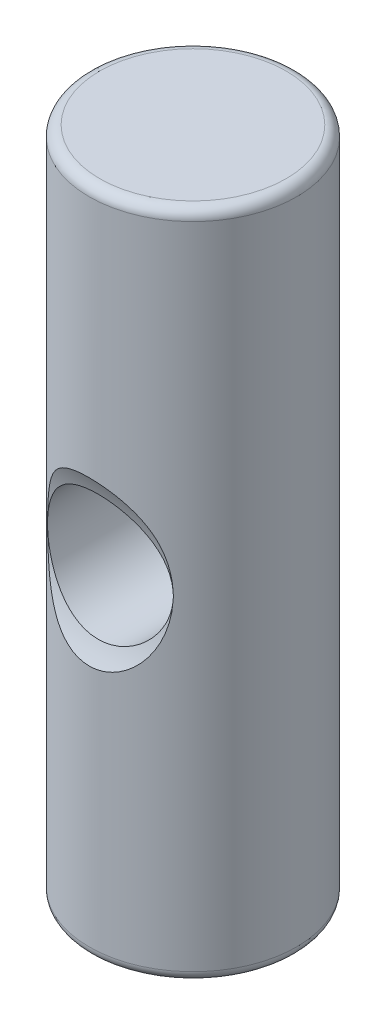
from build123d import *

# Parameters (mm, degrees)
SKETCH1_R               = 2.475
BOSS_EXTRUDE1_DEPTH     = 8
CUT_EXTRUDE1_DEPTH      = 9.732196173
CUT_EXTRUDE1_DEPTH_BACK = 9.732196173
SKETCH2_R               = 1.5
CUT_EXTRUDE3_DEPTH      = 9.732196321
CUT_EXTRUDE3_DEPTH_BACK = 9.732196321
SKETCH5_R               = 4
FILLET1_R               = 0.25


with BuildPart() as part:
    # Sketch1 → Boss-Extrude1 (new, symmetric)
    with BuildSketch(Plane(origin=(0, 0, 0), x_dir=(1, 0, 0), z_dir=(0, 1, 0))):
        with Locations(Location((0, 0, 0), (0, 0, 270))):
            Circle(SKETCH1_R)
    extrude(amount=BOSS_EXTRUDE1_DEPTH, both=True)

    # Sketch2 → Cut-Extrude1 (cut, two sides: drawn at the far end of the back side and taken through both)
    with BuildSketch(Plane.XY.offset(-CUT_EXTRUDE1_DEPTH_BACK)):
        with Locations(Location((0, 0, 0), (0, 0, 89.999999987))):
            Circle(SKETCH2_R)
    extrude(amount=CUT_EXTRUDE1_DEPTH + CUT_EXTRUDE1_DEPTH_BACK, mode=Mode.SUBTRACT)

    # Sketch5 → Cut-Extrude3 (cut, two sides: drawn at the far end of the back side and taken through both)
    with BuildSketch(Plane(origin=(0, 0, 0), x_dir=(0, 0, -1), z_dir=(1, 0, 0)).offset(-CUT_EXTRUDE3_DEPTH_BACK)):
        with Locations((-5.97, 0)):
            Circle(SKETCH5_R)
    extrude(amount=CUT_EXTRUDE3_DEPTH + CUT_EXTRUDE3_DEPTH_BACK, mode=Mode.SUBTRACT)

    # Fillet1
    fillet1_edges = [part.edges().sort_by_distance(p)[0] for p in [
        (0, -8, -2.475),
        (0, 8, -2.475),
    ]]
    fillet(fillet1_edges, radius=FILLET1_R)


solid = part.part
